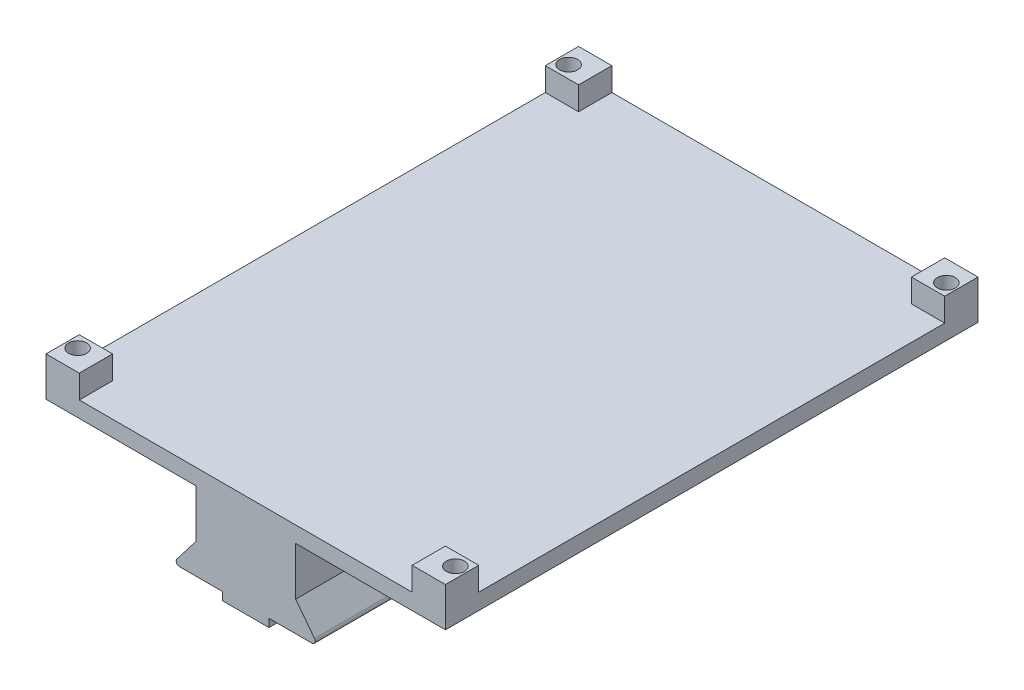
from build123d import *

# Parameters (mm, degrees)
BOSS_EXTRUDE1_DEPTH   = 101.6
SKETCH4_W             = 6.35
SKETCH4_H             = 88.9
CUT_EXTRUDE1_DEPTH    = 4.444119865
SKETCH5_W             = 6.35
SKETCH5_H             = 88.9
CUT_EXTRUDE2_DEPTH    = 4.444119865
F_4_CLEARANCE_HOLE1_D = 3.4544
F_4_CLEARANCE_HOLE2_D = 3.4544
F_4_CLEARANCE_HOLE3_D = 3.4544
F_4_CLEARANCE_HOLE4_D = 3.4544


with BuildPart() as part:
    # Sketch1 → Boss-Extrude1 (new body)
    with BuildSketch(Plane.XY):
        with BuildLine():
            Line((-9.525, 2.8575), (-9.525, 4.453010906))
            Line((-9.525, 4.453010906), (-9.525, 12.073010906))
            Line((-9.525, 12.073010906), (-38.1, 12.073010906))
            Line((-38.1, 12.073010906), (-38.1, 19.568949913))
            Line((-38.1, 19.568949913), (-31.75, 19.568949913))
            Line((-31.75, 19.568949913), (-31.75, 15.124830048))
            Line((-31.75, 15.124830048), (31.75, 15.124830048))
            Line((31.75, 15.124830048), (31.75, 19.568949913))
            Line((31.75, 19.568949913), (38.1, 19.568949913))
            Line((38.1, 19.568949913), (38.1, 12.073010906))
            Line((38.1, 12.073010906), (9.525, 12.073010906))
            Line((9.525, 12.073010906), (9.525, 4.453010906))
            Line((9.525, 4.453010906), (9.525, 2.8575))
            Line((9.525, 2.8575), (13.126400516, -1.835936531))
            ThreePointArc((13.126400516, -1.835936531), (13.192135312, -2.503353309), (12.622621186, -2.8575))
            Line((12.622621186, -2.8575), (9.525, -2.8575))
            Line((9.525, -2.8575), (4.445, -2.8575))
            Line((4.445, -2.8575), (4.445, -4.3815))
            Line((4.445, -4.3815), (-4.445, -4.3815))
            Line((-4.445, -4.3815), (-4.445, -2.8575))
            Line((-4.445, -2.8575), (-9.525, -2.8575))
            Line((-9.525, -2.8575), (-12.622621186, -2.8575))
            ThreePointArc((-12.622621186, -2.8575), (-13.192135312, -2.503353309), (-13.126400516, -1.835936531))
            Line((-13.126400516, -1.835936531), (-9.525, 2.8575))
        make_face()
    extrude(amount=BOSS_EXTRUDE1_DEPTH)

    # Sketch4 → Cut-Extrude1 (cut)
    with BuildSketch(Plane(origin=(0, 19.568949913, 0), x_dir=(1, 0, 0), z_dir=(0, 1, 0))):
        with Locations((-34.925, -50.8)):
            Rectangle(SKETCH4_W, SKETCH4_H)
    extrude(amount=-CUT_EXTRUDE1_DEPTH, mode=Mode.SUBTRACT)

    # Sketch5 → Cut-Extrude2 (cut)
    with BuildSketch(Plane(origin=(0, 19.568949913, 0), x_dir=(1, 0, 0), z_dir=(0, 1, 0))):
        with Locations((34.925, -50.8)):
            Rectangle(SKETCH5_W, SKETCH5_H)
    extrude(amount=-CUT_EXTRUDE2_DEPTH, mode=Mode.SUBTRACT)

    # #4 Clearance Hole1 (through all)
    with Locations(Plane(origin=(-36.03625, 19.568949913, 3.96875), x_dir=(0, 0, 1), z_dir=(0, 1, 0))):
        with Locations((0, 0)):
            Hole(F_4_CLEARANCE_HOLE1_D / 2)

    # #4 Clearance Hole2 (through all)
    with Locations(Plane(origin=(36.03625, 19.568949913, 3.96875), x_dir=(0, 0, 1), z_dir=(0, 1, 0))):
        with Locations((0, 0)):
            Hole(F_4_CLEARANCE_HOLE2_D / 2)

    # #4 Clearance Hole3 (through all)
    with Locations(Plane(origin=(-36.03625, 19.568949913, 97.63125), x_dir=(0, 0, 1), z_dir=(0, 1, 0))):
        with Locations((0, 0)):
            Hole(F_4_CLEARANCE_HOLE3_D / 2)

    # #4 Clearance Hole4 (through all)
    with Locations(Plane(origin=(36.03625, 19.568949913, 97.63125), x_dir=(0, 0, 1), z_dir=(0, 1, 0))):
        with Locations((0, 0)):
            Hole(F_4_CLEARANCE_HOLE4_D / 2)


solid = part.part
